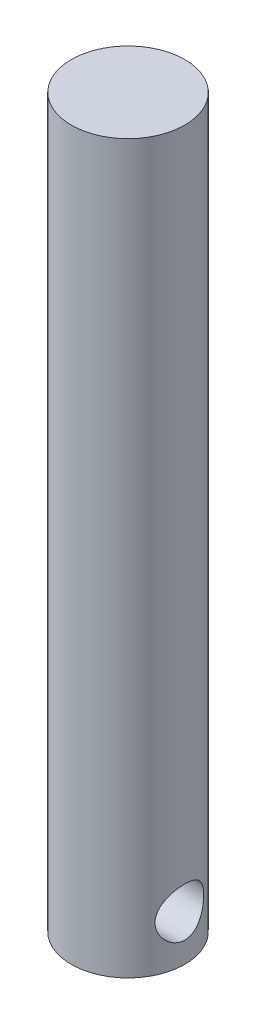
from build123d import *

# Parameters (mm, degrees)
SKETCH1_R           = 3.96875
BOSS_EXTRUDE1_DEPTH = 50.8
CUT_EXTRUDE1_REACH  = 53.569
SKETCH2_R           = 1.7


with BuildPart() as part:
    # Sketch1 → Boss-Extrude1 (new body)
    with BuildSketch(Plane(origin=(0, 0, 0), x_dir=(1, 0, 0), z_dir=(0, 1, 0))):
        with Locations(Location((0, 0, 0), (0, 0, 270))):
            Circle(SKETCH1_R)
    extrude(amount=BOSS_EXTRUDE1_DEPTH)

    # Sketch2 → Cut-Extrude1 (cut, up to next)
    with BuildSketch(Plane(origin=(3.96875, 0, 0), x_dir=(0, 0, -1), z_dir=(1, 0, 0)), mode=Mode.PRIVATE) as cut_extrude1_sk1:
        with Locations((0, 3.175)):
            Circle(SKETCH2_R)
    cut_extrude1_tool1 = extrude(cut_extrude1_sk1.sketch, amount=-CUT_EXTRUDE1_REACH, mode=Mode.PRIVATE) & part.part
    add(cut_extrude1_tool1.solids().sort_by_distance((3.96875, 3.175, 0))[0], mode=Mode.SUBTRACT)


solid = part.part
